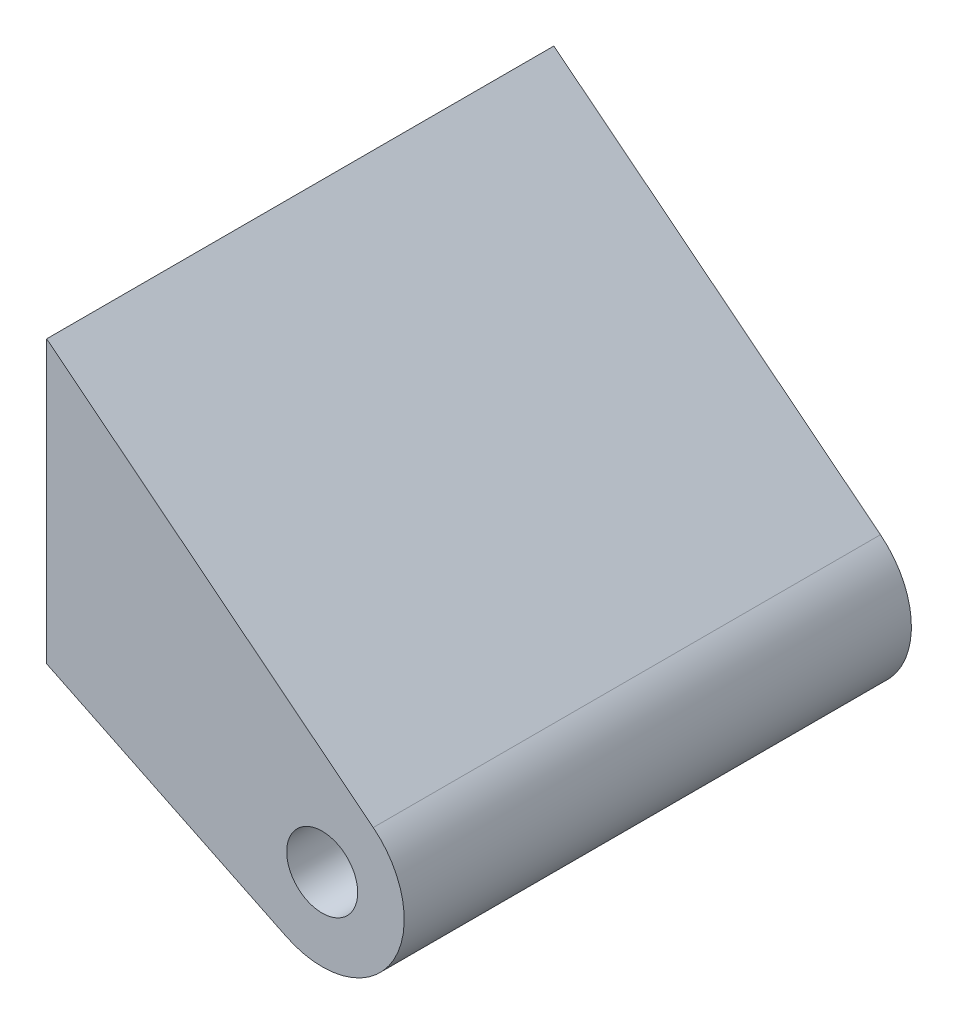
from build123d import *

# Parameters (mm, degrees)
SKETCH1_R           = 3.5
BOSS_EXTRUDE1_DEPTH = 50


with BuildPart() as part:
    # Sketch1 → Boss-Extrude1 (new body)
    with BuildSketch(Plane.XY):
        with BuildLine():
            Line((-32.198012743, 25.622059823), (0, 0))
            ThreePointArc((0, 0), (1.806353556, -10.633821759), (-8.564794356, -13.59699056))
            Line((-8.564794356, -13.59699056), (-32.198012743, -2.120093867))
            Line((-32.198012743, -2.120093867), (-32.198012743, 25.622059823))
        make_face()
        with Locations((-5.033507953, -6.325367841)):
            Circle(SKETCH1_R, mode=Mode.SUBTRACT)
    extrude(amount=BOSS_EXTRUDE1_DEPTH)


solid = part.part
